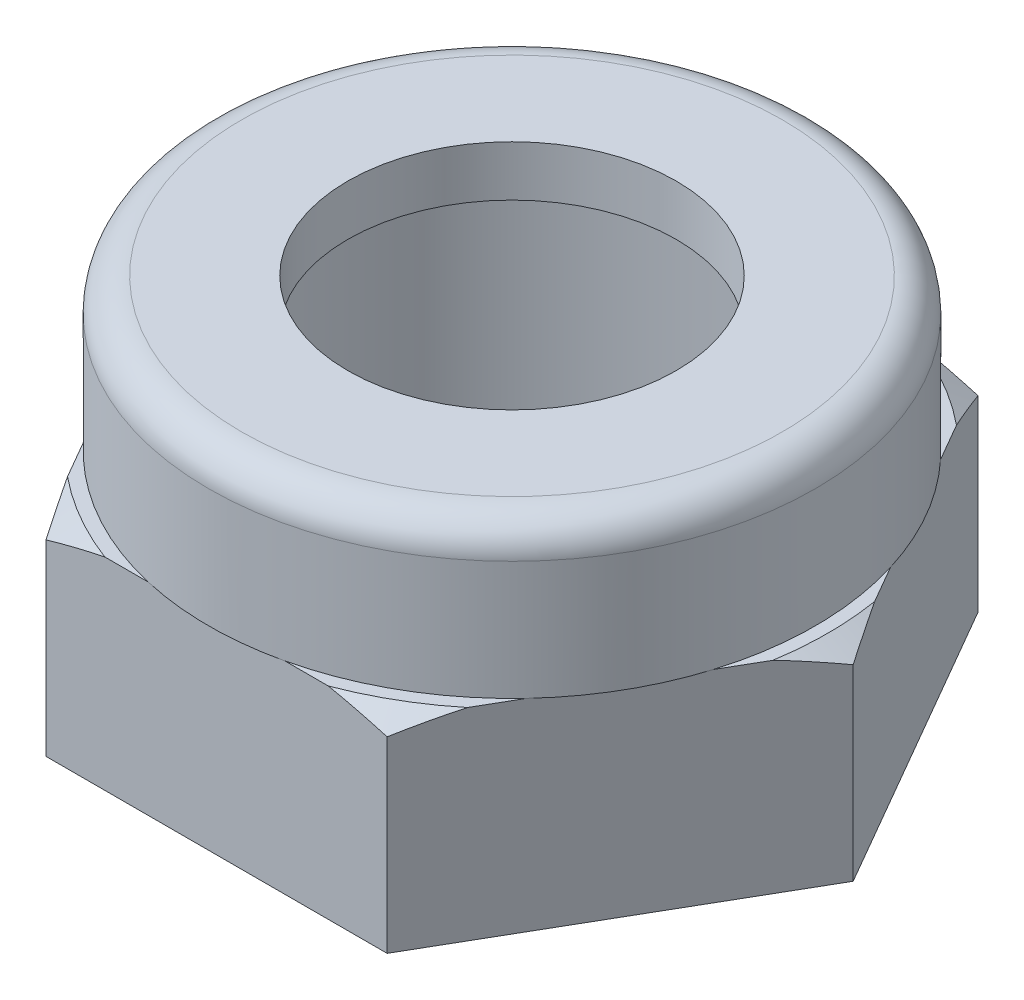
from build123d import *

# Parameters (mm, degrees)
FILLET1_R          = 1.3
CHAMFER1_SIZE      = 1
CHAMFER1_SIZE2     = 0.577350269
SKETCH2_OUTSIDE_W  = 37.134
SKETCH2_OUTSIDE_H  = 37.134
CUT_EXTRUDE1_DEPTH = 8
CHAMFER2_SIZE      = 1.6


with BuildPart() as part:
    # Sketch1 → Revolve1 (revolve)
    with BuildSketch(Plane(origin=(0, 0, 0), x_dir=(0, 0, -1), z_dir=(1, 0, 0))):
        Polygon((10, 0), (10, 12), (6.5, 12), (6.5, 14), (12, 14), (12, 8), (13.5, 8), (13.5, 0), align=None)
    revolve(axis=Axis((0, 0, 0), (0, 1, 0)))

    # Fillet1
    fillet1_edges = [part.edges().sort_by_distance(p)[0] for p in [
        (0, 14, 12),
    ]]
    fillet(fillet1_edges, radius=FILLET1_R)

    # Chamfer1
    chamfer1_edges = [part.edges().sort_by_distance(p)[0] for p in [
        (0, 8, 13.5),
    ]]
    chamfer1_side = [part.faces().sort_by_distance(p)[0] for p in [
        (0, 8, 12.381837662),
    ]]
    chamfer(chamfer1_edges, length=CHAMFER1_SIZE, length2=CHAMFER1_SIZE2, reference=chamfer1_side[0])

    # Sketch2 outside → Cut-Extrude1 (cut)
    with BuildSketch(Plane.XZ):
        Rectangle(SKETCH2_OUTSIDE_W, SKETCH2_OUTSIDE_H)
        Polygon((-13.5, 0), (-6.75, -11.691342951), (6.75, -11.691342951), (13.5, 0), (6.75, 11.691342951), (-6.75, 11.691342951), align=None, mode=Mode.SUBTRACT)
    extrude(amount=-CUT_EXTRUDE1_DEPTH, mode=Mode.SUBTRACT)

    # Chamfer2
    chamfer2_edges = [part.edges().sort_by_distance(p)[0] for p in [
        (0, 0, 10),
    ]]
    chamfer(chamfer2_edges, length=CHAMFER2_SIZE)


solid = part.part
